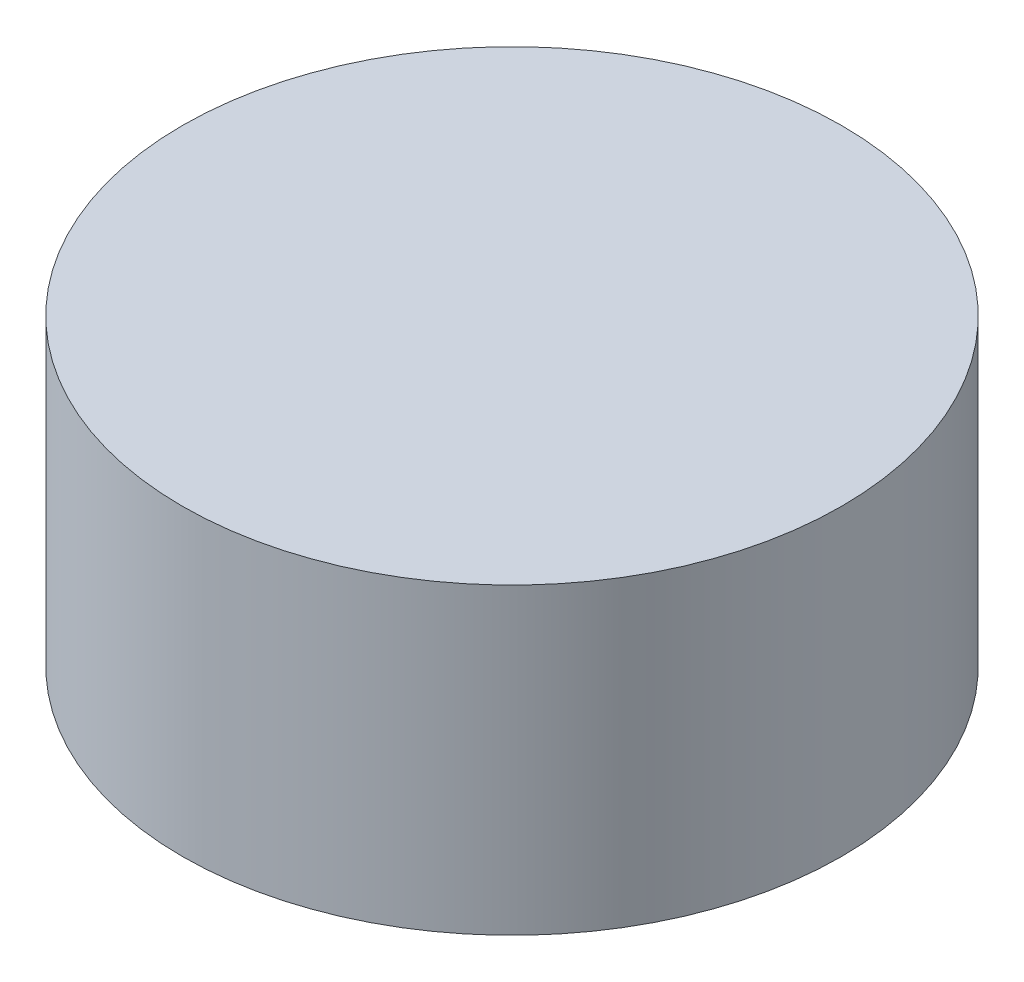
from build123d import *

# Parameters (mm, degrees)
BOSS_EXTRUDE1_DEPTH      = 23
BOSS_EXTRUDE1_DEPTH_BACK = 23
SKETCH1_R                = 50


with BuildPart() as part:
    # Sketch1 → Boss-Extrude1 (new, two sides: drawn at the far end of the back side and taken through both)
    with BuildSketch(Plane(origin=(0, 0, 0), x_dir=(1, 0, 0), z_dir=(0, 1, 0)).offset(-BOSS_EXTRUDE1_DEPTH_BACK)):
        with Locations(Location((0, 0, 0), (0, 0, 270))):
            Circle(SKETCH1_R)
    extrude(amount=BOSS_EXTRUDE1_DEPTH + BOSS_EXTRUDE1_DEPTH_BACK)


solid = part.part
